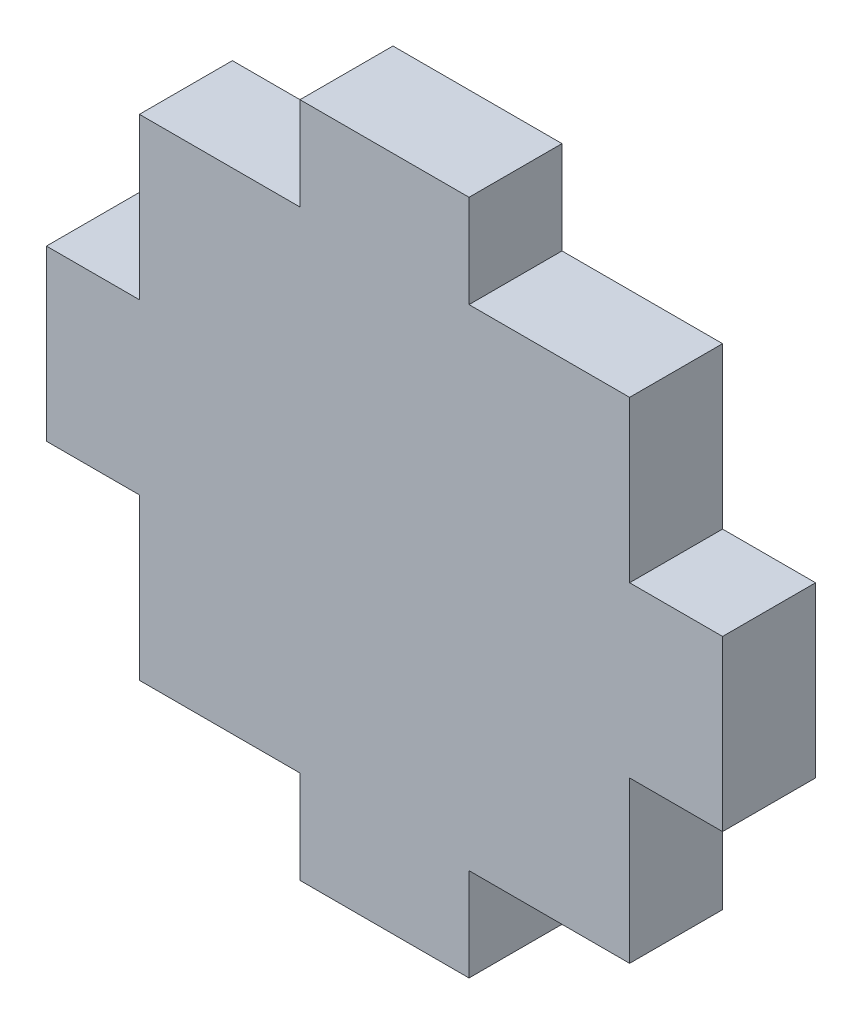
from build123d import *

# Parameters (mm, degrees)
EXTRUDE_1_DEPTH = 5.5


with BuildPart() as part:
    # ｽｹｯﾁ1 → ﾎﾞｽ - 押し出し1 (new body)
    with BuildSketch(Plane.XY):
        Polygon((-5, 14.5), (-14.5, 14.5), (-14.5, 5), (-20, 5), (-20, -5), (-14.5, -5), (-14.5, -14.5), (-5, -14.5), (-5, -20), (5, -20), (5, -14.5), (14.5, -14.5), (14.5, -5), (20, -5), (20, 5), (14.5, 5), (14.5, 14.5), (5, 14.5), (5, 20), (-5, 20), align=None)
    extrude(amount=EXTRUDE_1_DEPTH)


solid = part.part
